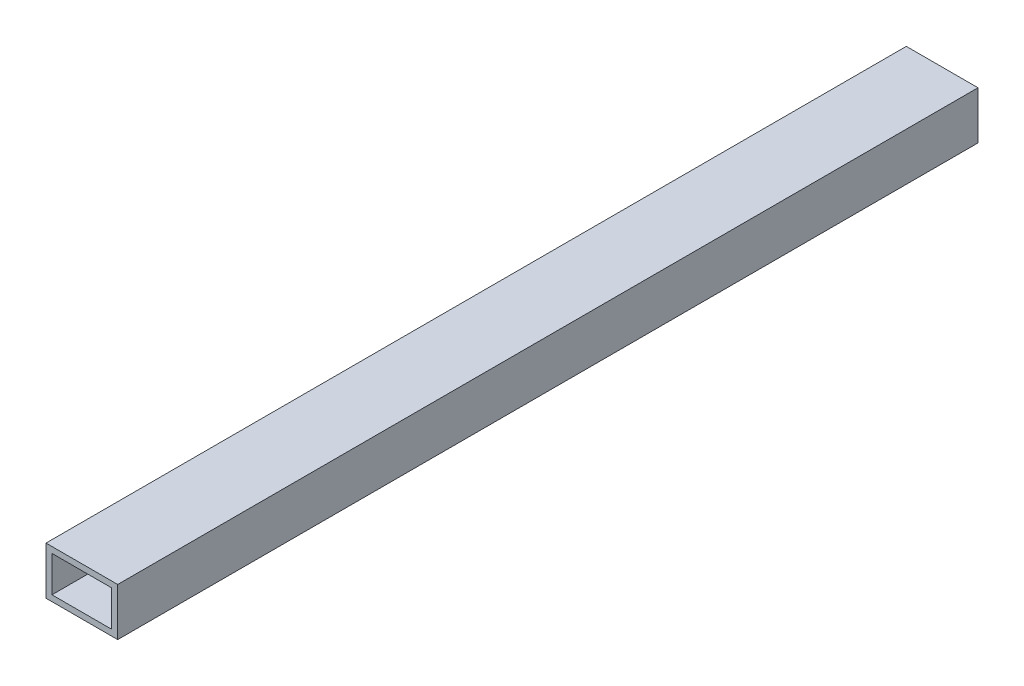
from build123d import *

# Parameters (mm, degrees)
BOSS_EXTRUDE1_DEPTH      = 228.6
BOSS_EXTRUDE1_DEPTH_BACK = 228.6
SKETCH3_W                = 38.1
SKETCH3_H                = 25.4
SKETCH3_W_2              = 31.75
SKETCH3_H_2              = 19.05


with BuildPart() as part:
    # Sketch3 → Boss-Extrude1 (new, two sides: drawn at the far end of the back side and taken through both)
    with BuildSketch(Plane.XY.offset(-BOSS_EXTRUDE1_DEPTH_BACK)):
        Rectangle(SKETCH3_W, SKETCH3_H)
        Rectangle(SKETCH3_W_2, SKETCH3_H_2, mode=Mode.SUBTRACT)
    extrude(amount=BOSS_EXTRUDE1_DEPTH + BOSS_EXTRUDE1_DEPTH_BACK)


solid = part.part
